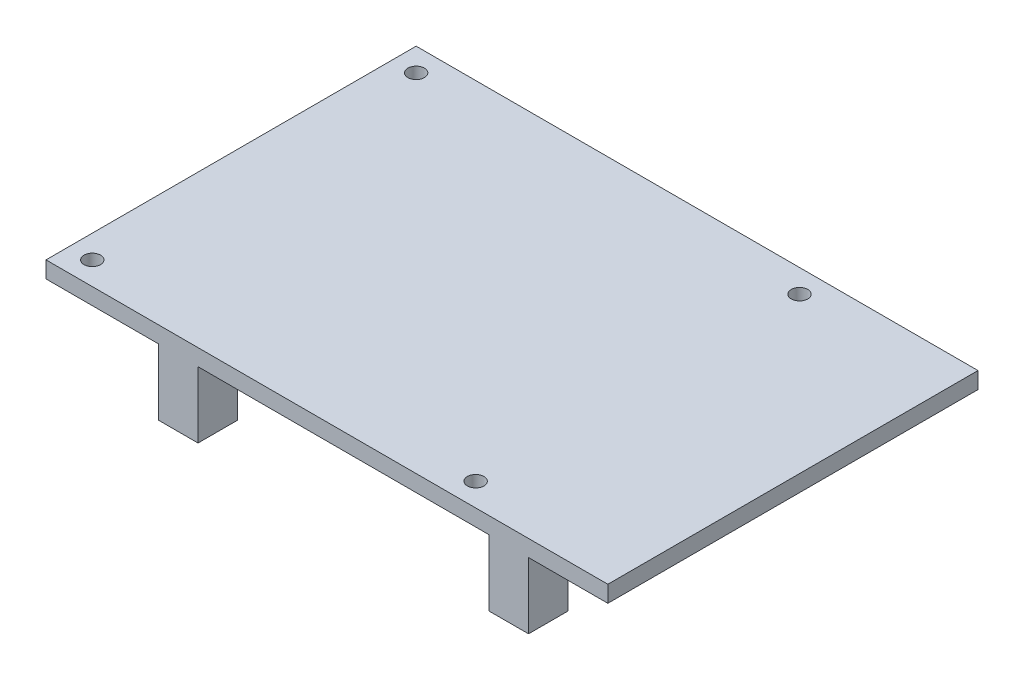
from build123d import *

# Parameters (mm, degrees)
SKETCH1_W                   = 85
SKETCH1_H                   = 56
BOSS_EXTRUDE1_DEPTH         = 2.5
TAP_DRILL_FOR_M3X0_5_TAP2_D = 2.5
SKETCH5_W                   = 6
SKETCH5_H                   = 6
BOSS_EXTRUDE2_DEPTH         = 10


with BuildPart() as part:
    # Sketch1 → Boss-Extrude1 (new body)
    with BuildSketch(Plane(origin=(0, 0, 0), x_dir=(1, 0, 0), z_dir=(0, 1, 0))):
        with Locations((42.5, -28)):
            Rectangle(SKETCH1_W, SKETCH1_H)
    extrude(amount=BOSS_EXTRUDE1_DEPTH)

    # Tap Drill for M3x0.5 Tap2 (through all)
    with Locations(Plane(origin=(0, 2.5, 0), x_dir=(1, 0, 0), z_dir=(0, 1, 0))):
        with Locations((3.5, -3.5), (61.5, -3.5), (61.5, -52.5), (3.5, -52.5)):
            Hole(TAP_DRILL_FOR_M3X0_5_TAP2_D / 2)

    # Sketch5 → Boss-Extrude2 (add)
    with BuildSketch(Plane.XZ):
        with Locations((20, 3)):
            Rectangle(SKETCH5_W, SKETCH5_H)
        with Locations((20, 53)):
            Rectangle(SKETCH5_W, SKETCH5_H)
        with Locations((70, 3)):
            Rectangle(SKETCH5_W, SKETCH5_H)
        with Locations((70, 53)):
            Rectangle(SKETCH5_W, SKETCH5_H)
    extrude(amount=BOSS_EXTRUDE2_DEPTH)


solid = part.part
